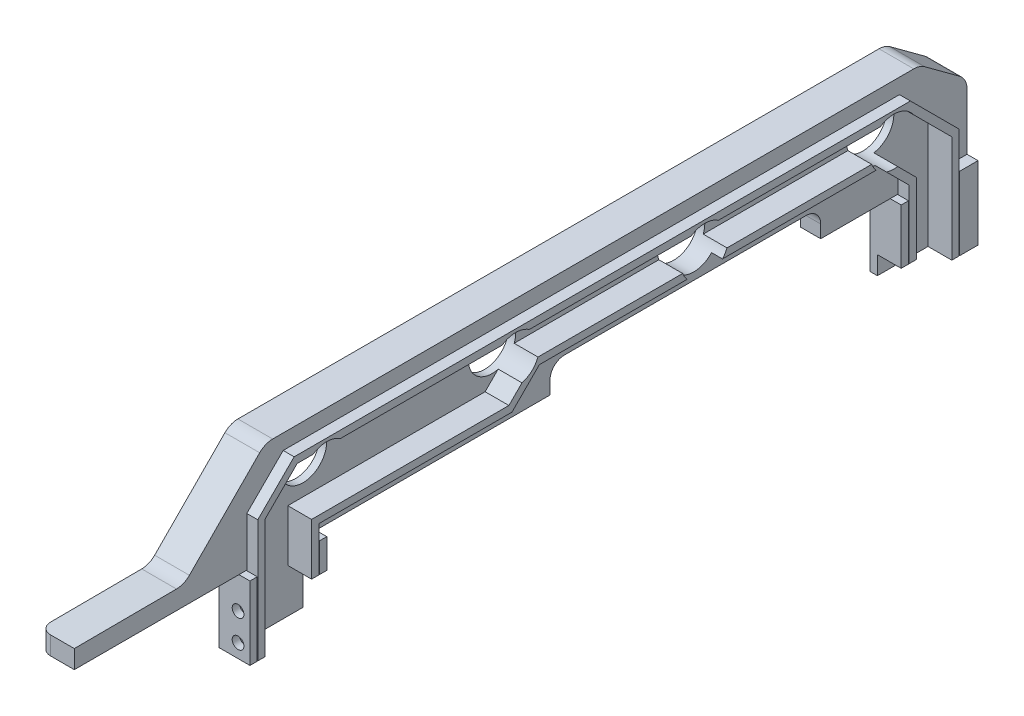
from build123d import *

# Parameters (mm, degrees)
BOSS_EXTRUDE1_DEPTH          = 25
CUT_EXTRUDE1_DEPTH           = 4
FILLET1_R                    = 4
FILLET2_R                    = 10
FILLET3_R                    = 5
FILLET4_R                    = 3
BOSS_EXTRUDE2_DEPTH          = 3
BOSS_EXTRUDE2_DEPTH_BACK     = 3
FILLET5_R                    = 3
SKETCH6_W                    = 13
SKETCH6_H                    = 14
BOSS_EXTRUDE3_DEPTH          = 20
BOSS_EXTRUDE4_DEPTH          = 20
SKETCH9_W                    = 13
SKETCH9_H                    = 2
BOSS_EXTRUDE5_DEPTH          = 8
SKETCH7_W                    = 13
SKETCH7_H                    = 2
CUT_EXTRUDE2_DEPTH           = 5
SKETCH11_R                   = 1.6
CUT_EXTRUDE3_DEPTH           = 19
CUT_EXTRUDE4_START           = -2
SKETCH12_R                   = 1.6
CUT_EXTRUDE4_DEPTH           = 2
CUT_EXTRUDE5_DEPTH           = 6.5
CUT_EXTRUDE5_DEPTH_BACK      = 6.5
CUT_EXTRUDE7_DEPTH           = 247.814201374
BOSS_EXTRUDE6_DEPTH          = 6.5
BOSS_EXTRUDE8_DEPTH          = 3.5
MAKE_THIS_A_SQUARE_OR_SMTH_R = 6.5
CUT_EXTRUDE8_DEPTH           = 134.148413434


with BuildPart() as part:
    # Sketch1 → Boss-Extrude1 (new body)
    with BuildSketch(Plane(origin=(0, 0, 0), x_dir=(0, 0, -1), z_dir=(1, 0, 0))):
        Polygon((0, 0), (-130, 0), (-130, 5), (-100.000366453, 5.148280317), (-77.868517379, 27.5), (101.088229162, 27.5), (114, 18), (114, 0), (74, 0), (74, 7.5), (0, 7.5), align=None)
    extrude(amount=BOSS_EXTRUDE1_DEPTH)

    # Sketch4 → Cut-Extrude1 (cut)
    with BuildSketch(Plane(origin=(25, 0, 0), x_dir=(0, 0, -1), z_dir=(1, 0, 0))):
        Polygon((-100.876178749, 0), (0, 0), (111, 0), (111, 3), (111, 16.482758557), (100.103496394, 24.5), (-76.617181678, 24.5), align=None)
    cut_extrude1 = extrude(amount=-CUT_EXTRUDE1_DEPTH, mode=Mode.SUBTRACT)

    # Mirror2: Cut-Extrude1 across plane
    add(cut_extrude1.mirror(Plane(origin=(12.5, 0, 0), x_dir=(0, 0, 1), z_dir=(1, 0, 0))), mode=Mode.SUBTRACT)

    # Fillet1
    fillet1_edges = [part.edges().sort_by_distance(p)[0] for p in [
        (12.5, 7.5, -74),
        (12.5, 7.5, 0),
    ]]
    fillet(fillet1_edges, radius=FILLET1_R)

    # Fillet2
    fillet2_edges = [part.edges().sort_by_distance(p)[0] for p in [
        (23, 0, 100.876178749),
        (23, 24.5, 76.617181678),
        (23, 24.5, -100.103496394),
        (23, 16.482758557, -111),
        (2, 0, 100.876178749),
        (2, 16.482758557, -111),
        (2, 24.5, -100.103496394),
        (2, 24.5, 76.617181678),
    ]]
    fillet(fillet2_edges, radius=FILLET2_R)

    # Fillet3
    fillet3_edges = [part.edges().sort_by_distance(p)[0] for p in [
        (12.5, 5.148280317, 100.000366453),
        (12.5, 27.5, 77.868517379),
        (12.5, 27.5, -101.088229162),
        (12.5, 18, -114),
    ]]
    fillet(fillet3_edges, radius=FILLET3_R)

    # Fillet4
    fillet4_edges = [part.edges().sort_by_distance(p)[0] for p in [
        (0, 2.5, 130),
        (25, 2.5, 130),
    ]]
    fillet(fillet4_edges, radius=FILLET4_R)

    # Sketch5 → Boss-Extrude2 (add, two sides: drawn at the far end of the back side and taken through both)
    with BuildSketch(Plane(origin=(12.5, 0, 0), x_dir=(0, 0, -1), z_dir=(1, 0, 0)).offset(-BOSS_EXTRUDE2_DEPTH_BACK)):
        Polygon((-117.8659777, 5.059975288), (-103.793914836, 19.271838176), (-72.605250228, 19.271838176), (-95.8659777, 5.059975288), align=None)
    extrude(amount=BOSS_EXTRUDE2_DEPTH + BOSS_EXTRUDE2_DEPTH_BACK)

    # Fillet5
    fillet5_edges = [part.edges().sort_by_distance(p)[0] for p in [
        (12.5, 19.271838176, 103.793914836),
    ]]
    fillet(fillet5_edges, radius=FILLET5_R)

    # Sketch6 → Boss-Extrude3 (add)
    with BuildSketch(Plane.XZ):
        Polygon((0, -111), (4, -111), (4, -93), (21, -93), (21, -111), (25, -111), (25, -114), (0, -114), align=None)
        with Locations((12.5, -102)):
            Rectangle(SKETCH6_W, SKETCH6_H, mode=Mode.SUBTRACT)
    extrude(amount=BOSS_EXTRUDE3_DEPTH)

    # Sketch8 → Boss-Extrude4 (add)
    with BuildSketch(Plane.XZ):
        Polygon((21, 85), (4, 85), (4, 64), (6, 64), (6, 83), (19, 83), (19, 64), (21, 64), align=None)
    extrude(amount=BOSS_EXTRUDE4_DEPTH)

    # Sketch9 → Boss-Extrude5 (add)
    with BuildSketch(Plane.XZ):
        with Locations((12.5, 65)):
            Rectangle(SKETCH9_W, SKETCH9_H)
    extrude(amount=BOSS_EXTRUDE5_DEPTH)

    # Sketch7 → Cut-Extrude2 (cut)
    with BuildSketch(Plane.XZ.offset(20)):
        with Locations((12.5, -94)):
            Rectangle(SKETCH7_W, SKETCH7_H)
    extrude(amount=-CUT_EXTRUDE2_DEPTH, mode=Mode.SUBTRACT)

    # Sketch11 → Cut-Extrude3 (cut)
    with BuildSketch(Plane(origin=(0, 0, -114), x_dir=(-1, 0, 0), z_dir=(0, 0, -1))):
        with Locations((-15.75, -16.25)):
            Circle(SKETCH11_R)
        with Locations((-15.75, -8.75)):
            Circle(SKETCH11_R)
        with Locations((-9.25, -8.75)):
            Circle(SKETCH11_R)
        with Locations((-9.25, -16.25)):
            Circle(SKETCH11_R)
    extrude(amount=-CUT_EXTRUDE3_DEPTH, mode=Mode.SUBTRACT)

    # Sketch12 → Cut-Extrude4 (cut)
    with BuildSketch(Plane.XY.offset(85).offset(CUT_EXTRUDE4_START)):
        with Locations(Location((15.75, -16.25, 0), (0, 0, 180))):
            Circle(SKETCH12_R)
        with Locations(Location((9.25, -16.25, 0), (0, 0, 180))):
            Circle(SKETCH12_R)
        with Locations(Location((9.25, -8.75, 0), (0, 0, 180))):
            Circle(SKETCH12_R)
        with Locations(Location((15.75, -8.75, 0), (0, 0, 180))):
            Circle(SKETCH12_R)
    extrude(amount=CUT_EXTRUDE4_DEPTH, mode=Mode.SUBTRACT)

    # Sketch14 → Cut-Extrude5 (cut, two sides: drawn at the far end of the back side and taken through both)
    with BuildSketch(Plane(origin=(12.5, 0, 0), x_dir=(0, 0, -1), z_dir=(1, 0, 0)).offset(-CUT_EXTRUDE5_DEPTH_BACK)):
        Polygon((-83, 0), (-83, 13.475167258), (-72.975167258, 23.5), (95.592427597, 23.5), (109, 10.092427597), (109, 0), (95, 0), (95, 3.57939317), (87.07939317, 11.5), (-5.825100808, 11.5), (-13.325100808, 4), (-66, 4), (-66, 0), align=None)
    extrude(amount=CUT_EXTRUDE5_DEPTH + CUT_EXTRUDE5_DEPTH_BACK, mode=Mode.SUBTRACT)

    # Sketch17 → Cut-Extrude7 (cut, through all)
    with BuildSketch(Plane.XY.offset(130)):
        Polygon((12.5, -20), (25, -20), (25, 27.5), (9.5, 27.5), (9.5, 5.138043697), (9.5, 0), (12.5, 0), align=None)
    extrude(amount=-CUT_EXTRUDE7_DEPTH, mode=Mode.SUBTRACT)

    # Sketch18 → Boss-Extrude6 (add)
    with BuildSketch(Plane(origin=(6, 0, 0), x_dir=(0, 0, -1), z_dir=(1, 0, 0))):
        Polygon((-66.15, -8), (-68.15, -8), (-68.15, 6.15), (-14.215659968, 6.15), (-6.715659968, 13.65), (87.96995233, 13.65), (97.15, 4.46995233), (97.15, -15), (95.15, -15), (95.15, 3.641525205), (87.141525205, 11.65), (-5.887232843, 11.65), (-13.387232843, 4.15), (-66.15, 4.15), align=None)
        Polygon((-82.85, -20), (-82.85, 13.413035223), (-72.913035223, 23.35), (95.530295563, 23.35), (108.85, 10.030295563), (108.85, -20), (106.85, -20), (106.85, 9.201868438), (94.701868438, 21.35), (-72.084608099, 21.35), (-80.85, 12.584608099), (-80.85, -20), align=None)
    extrude(amount=BOSS_EXTRUDE6_DEPTH)

    # Sketch24 → Boss-Extrude8 (add)
    with BuildSketch(Plane(origin=(6, 0, 0), x_dir=(0, 0, -1), z_dir=(1, 0, 0))):
        Polygon((-83, -20), (-82.85, -20), (-82.85, 13.413035223), (-72.913035223, 23.35), (95.530295563, 23.35), (108.85, 10.030295563), (108.85, -20), (109, -20), (109, 10.092427597), (95.592427597, 23.5), (-72.975167258, 23.5), (-83, 13.475167258), align=None)
        Polygon((-66.15, -8), (-66, -8), (-66, 4), (-13.325100808, 4), (-5.825100808, 11.5), (87.07939317, 11.5), (95, 3.57939317), (95, -15), (95.15, -15), (95.15, 3.641525205), (87.141525205, 11.65), (-5.887232843, 11.65), (-13.387232843, 4.15), (-66.15, 4.15), align=None)
    extrude(amount=BOSS_EXTRUDE8_DEPTH)

    # MAKE THIS A SQUARE OR SMTH → Cut-Extrude8 (cut, through all)
    with BuildSketch(Plane.ZY.offset(-4)):
        with Locations((-91, 16)):
            Circle(MAKE_THIS_A_SQUARE_OR_SMTH_R)
        with Locations((-39.333333333, 16)):
            Circle(MAKE_THIS_A_SQUARE_OR_SMTH_R)
        with Locations(Location((64, 16, 0), (0, 0, 55.394002372))):
            Circle(MAKE_THIS_A_SQUARE_OR_SMTH_R)
        with Locations(Location((12.333333333, 16, 0), (0, 0, 55.394002372))):
            Circle(MAKE_THIS_A_SQUARE_OR_SMTH_R)
    extrude(amount=-CUT_EXTRUDE8_DEPTH, mode=Mode.SUBTRACT)


solid = part.part
